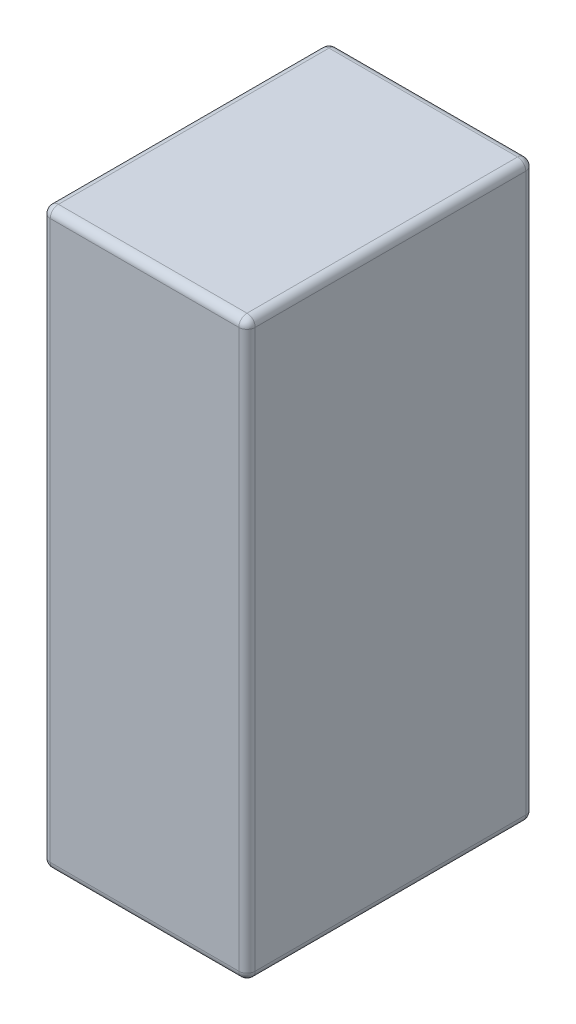
from build123d import *

# Parameters (mm, degrees)
SKETCH1_W           = 25
SKETCH1_H           = 35
BOSS_EXTRUDE1_DEPTH = 70
FILLET1_R           = 1


with BuildPart() as part:
    # Sketch1 → Boss-Extrude1 (new body)
    with BuildSketch(Plane(origin=(0, 0, 0), x_dir=(1, 0, 0), z_dir=(0, 1, 0))):
        with Locations((12.5, 17.5)):
            Rectangle(SKETCH1_W, SKETCH1_H)
    extrude(amount=BOSS_EXTRUDE1_DEPTH)

    # Fillet1
    fillet1_edges = [part.edges().sort_by_distance(p)[0] for p in [
        (25, 70, -17.5),
        (12.5, 70, -35),
        (0, 70, -17.5),
        (12.5, 0, -35),
        (25, 0, -17.5),
        (12.5, 0, 0),
        (0, 0, -17.5),
        (0, 35, -35),
        (25, 35, -35),
        (25, 35, 0),
        (0, 35, 0),
        (12.5, 70, 0),
    ]]
    fillet(fillet1_edges, radius=FILLET1_R)


solid = part.part
